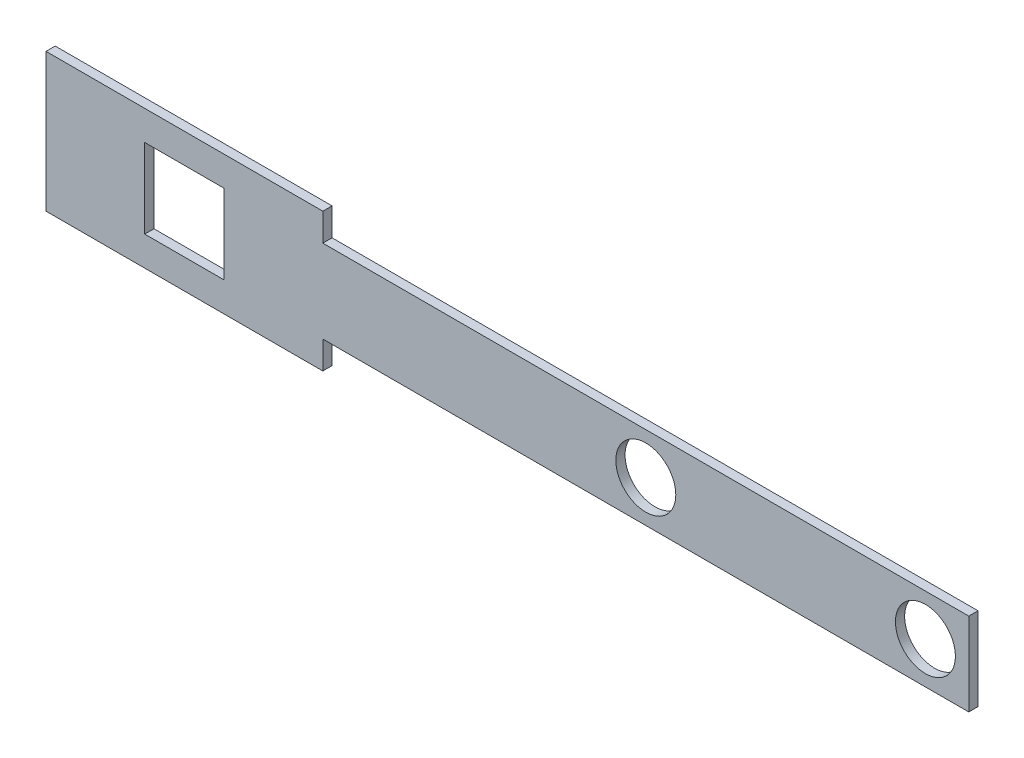
from build123d import *

# Parameters (mm, degrees)
BOSS_EXTRUDE1_DEPTH     = 1
SKETCH3_W               = 8.6
SKETCH3_H               = 8.6
CUT_EXTRUDE2_DEPTH      = 102.123686642
CUT_EXTRUDE3_DEPTH      = 102.123686642
CUT_EXTRUDE3_DEPTH_BACK = 102.123686642
SKETCH5_R               = 3.25


with BuildPart() as part:
    # Sketch1 → Boss-Extrude1 (new body)
    with BuildSketch(Plane.XY):
        Polygon((30, -3), (30, 0), (0, 0), (0, -15), (30, -15), (30, -12), (100, -12), (100, -3), align=None)
    extrude(amount=BOSS_EXTRUDE1_DEPTH)

    # Sketch3 → Cut-Extrude2 (cut, through all)
    with BuildSketch(Plane(origin=(0, 0, 0), x_dir=(-1, 0, 0), z_dir=(0, 0, -1))):
        with Locations((-15, -7.5)):
            Rectangle(SKETCH3_W, SKETCH3_H)
    extrude(amount=-CUT_EXTRUDE2_DEPTH, mode=Mode.SUBTRACT)

    # Sketch5 → Cut-Extrude3 (cut, two sides: drawn at the far end of the back side and taken through both)
    with BuildSketch(Plane.XY.offset(1).offset(-CUT_EXTRUDE3_DEPTH_BACK)):
        with Locations((65, -7.5)):
            Circle(SKETCH5_R)
        with Locations((95.3, -7.5)):
            Circle(SKETCH5_R)
    extrude(amount=CUT_EXTRUDE3_DEPTH + CUT_EXTRUDE3_DEPTH_BACK, mode=Mode.SUBTRACT)


solid = part.part
